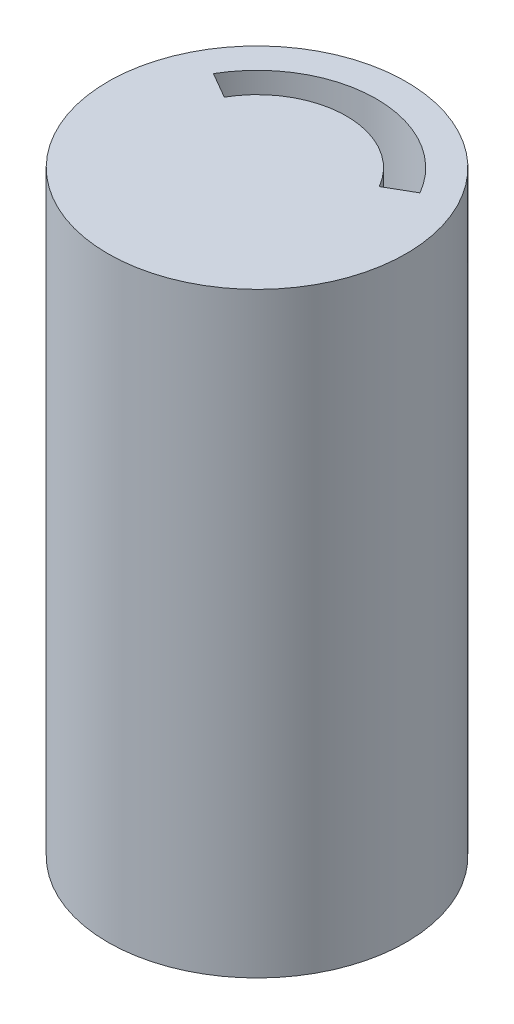
from build123d import *

# Parameters (mm, degrees)
SKETCH1_R           = 5
BOSS_EXTRUDE1_DEPTH = 20
SKETCH2_R           = 0.75
CUT_EXTRUDE1_DEPTH  = 15


with BuildPart() as part:
    # Sketch1 → Boss-Extrude1 (new body)
    with BuildSketch(Plane(origin=(0, 0, 0), x_dir=(1, 0, 0), z_dir=(0, 1, 0))):
        with Locations(Location((0, 0, 0), (0, 0, 270))):
            Circle(SKETCH1_R)
        with BuildLine():
            Line((-3.464101615, 2), (-2.598076211, 1.5))
            ThreePointArc((-2.598076211, 1.5), (0, 3), (2.598076211, 1.5))
            Line((2.598076211, 1.5), (3.464101615, 2))
            ThreePointArc((3.464101615, 2), (0, 4), (-3.464101615, 2))
        make_face(mode=Mode.SUBTRACT)
    extrude(amount=BOSS_EXTRUDE1_DEPTH)

    # Sketch2 → Cut-Extrude1 (cut)
    with BuildSketch(Plane.XZ):
        with Locations(Location((0, 0, 0), (0, 0, 270))):
            Circle(SKETCH2_R)
    extrude(amount=-CUT_EXTRUDE1_DEPTH, mode=Mode.SUBTRACT)


solid = part.part
